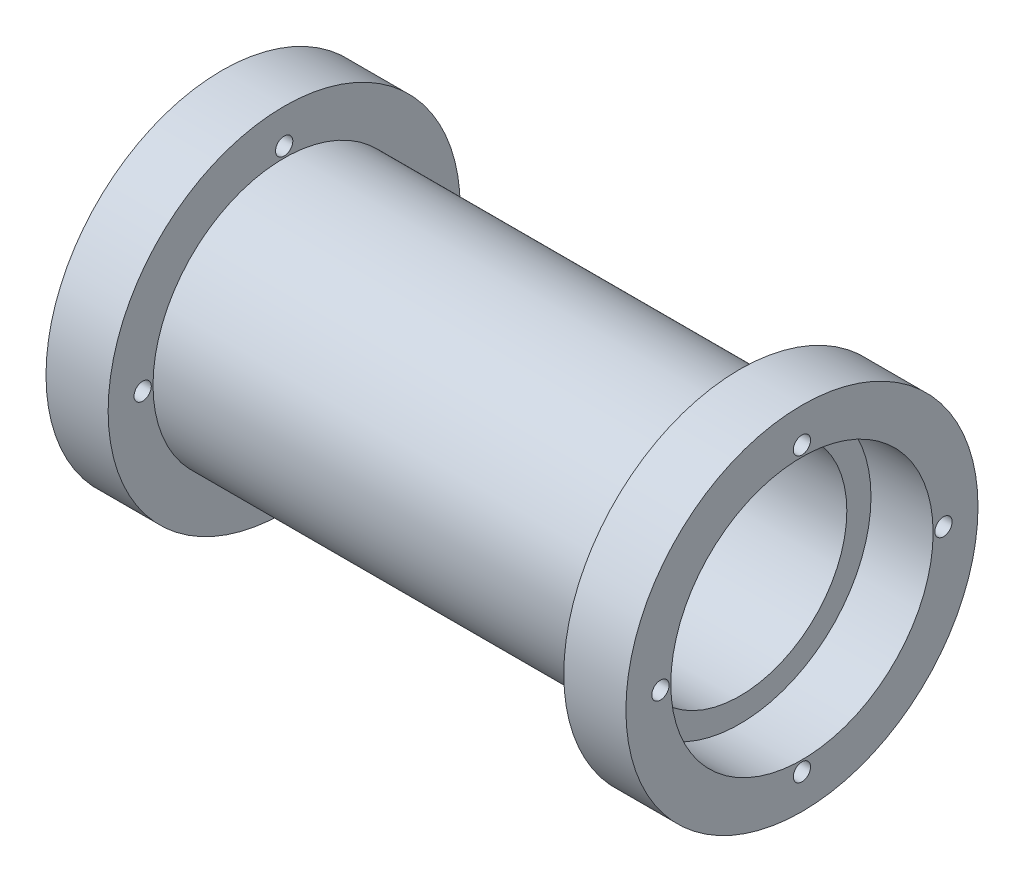
from build123d import *

# Parameters (mm, degrees)
SKETCH_1_R          = 51
SKETCH_1_R_2        = 31
EXTRUDE_1_DEPTH     = 18
SKETCH_2_R          = 38
SKETCH_2_R_2        = 31
EXTRUDE_2_DEPTH     = 132
SKETCH_3_R          = 51
SKETCH_3_R_2        = 38
EXTRUDE_3_DEPTH     = 18
CUT_EXTRUDE_START   = -168
SKETCH_4_R          = 2.5
CUT_EXTRUDE_1_DEPTH = 168


with BuildPart() as part:
    # 草图1 → 凸台-拉伸1 (new body)
    with BuildSketch(Plane(origin=(0, 0, 0), x_dir=(0, 0, -1), z_dir=(1, 0, 0))):
        Circle(SKETCH_1_R)
        Circle(SKETCH_1_R_2, mode=Mode.SUBTRACT)
    extrude(amount=EXTRUDE_1_DEPTH)

    # 草图2 → 凸台-拉伸2 (add)
    with BuildSketch(Plane(origin=(18, 0, 0), x_dir=(0, 0, -1), z_dir=(1, 0, 0))):
        Circle(SKETCH_2_R)
        Circle(SKETCH_2_R_2, mode=Mode.SUBTRACT)
    extrude(amount=EXTRUDE_2_DEPTH)


with BuildPart() as body_2:
    # 草图3 → 凸台-拉伸3 (new body)
    with BuildSketch(Plane(origin=(150, 0, 0), x_dir=(0, 0, -1), z_dir=(1, 0, 0))):
        Circle(SKETCH_3_R)
        Circle(SKETCH_3_R_2, mode=Mode.SUBTRACT)
    extrude(amount=EXTRUDE_3_DEPTH)


with BuildPart() as cut_extrude_1_tool:
    # 草图4 → 切除-拉伸1 (new body)
    with BuildSketch(Plane.ZY.offset(CUT_EXTRUDE_START)):
        with Locations(Location((0, 41, 0), (0, 0, 180))):
            Circle(SKETCH_4_R)
        with Locations(Location((41, 0, 0), (0, 0, 180))):
            Circle(SKETCH_4_R)
        with Locations(Location((0, -41, 0), (0, 0, 180))):
            Circle(SKETCH_4_R)
        with Locations(Location((-41, 0, 0), (0, 0, 180))):
            Circle(SKETCH_4_R)
    extrude(amount=CUT_EXTRUDE_1_DEPTH)


with BuildPart() as part_1:
    add(part.part)

    # 切除-拉伸1: cut by cut_extrude_1_tool
    add(cut_extrude_1_tool.part, mode=Mode.SUBTRACT)


with BuildPart() as body_2_1:
    add(body_2.part)

    # 切除-拉伸1: cut by cut_extrude_1_tool
    add(cut_extrude_1_tool.part, mode=Mode.SUBTRACT)


solid = Compound([part_1.part, body_2_1.part])
